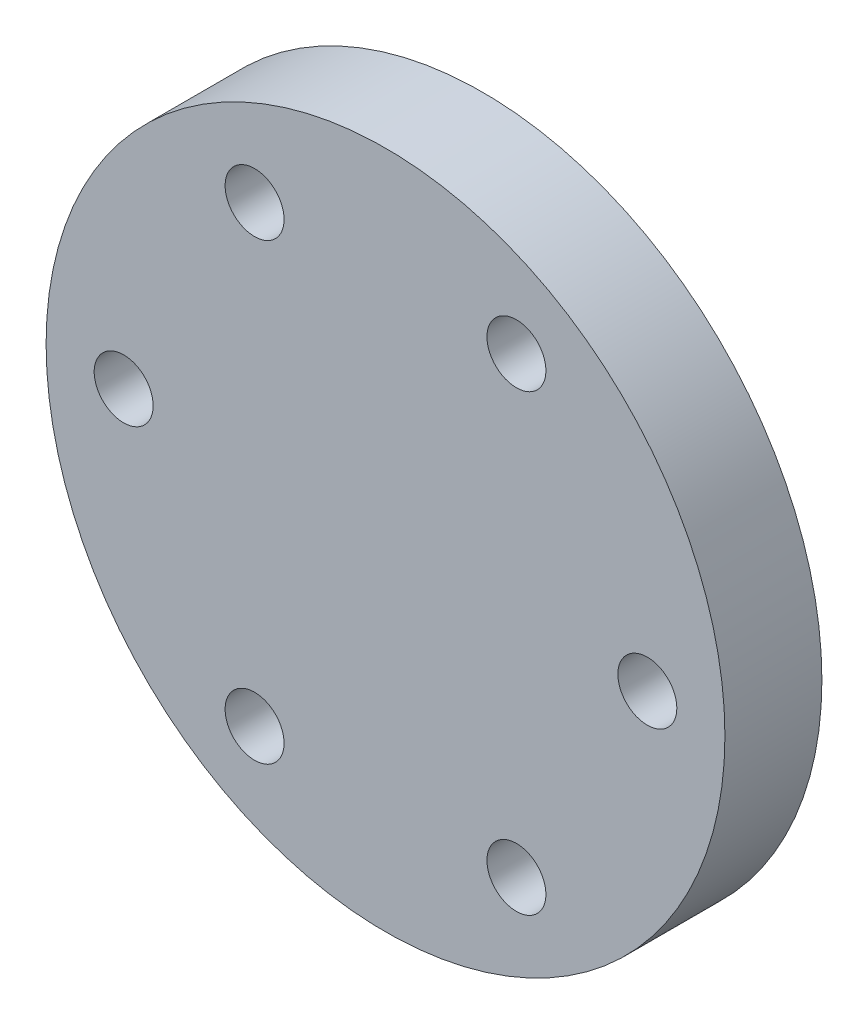
from build123d import *

# Parameters (mm, degrees)
ROTATING_OUTPUT_INTERFACE_START = -5
PROFILE_1_R                     = 17.5
PROFILE_1_R_2                   = 1.52
ROTATING_OUTPUT_INTERFACE_DEPTH = 5


with BuildPart() as part:
    # Profile_1 → Rotating_output_interface (new body)
    with BuildSketch(Plane.XY.offset(ROTATING_OUTPUT_INTERFACE_START)):
        Circle(PROFILE_1_R)
        with Locations((13.5, 0)):
            Circle(PROFILE_1_R_2, mode=Mode.SUBTRACT)
        with Locations((6.75, 11.691342951)):
            Circle(PROFILE_1_R_2, mode=Mode.SUBTRACT)
        with Locations((-6.75, 11.691342951)):
            Circle(PROFILE_1_R_2, mode=Mode.SUBTRACT)
        with Locations((-13.5, 0)):
            Circle(PROFILE_1_R_2, mode=Mode.SUBTRACT)
        with Locations((-6.75, -11.691342951)):
            Circle(PROFILE_1_R_2, mode=Mode.SUBTRACT)
        with Locations((6.75, -11.691342951)):
            Circle(PROFILE_1_R_2, mode=Mode.SUBTRACT)
    extrude(amount=ROTATING_OUTPUT_INTERFACE_DEPTH)


solid = part.part
